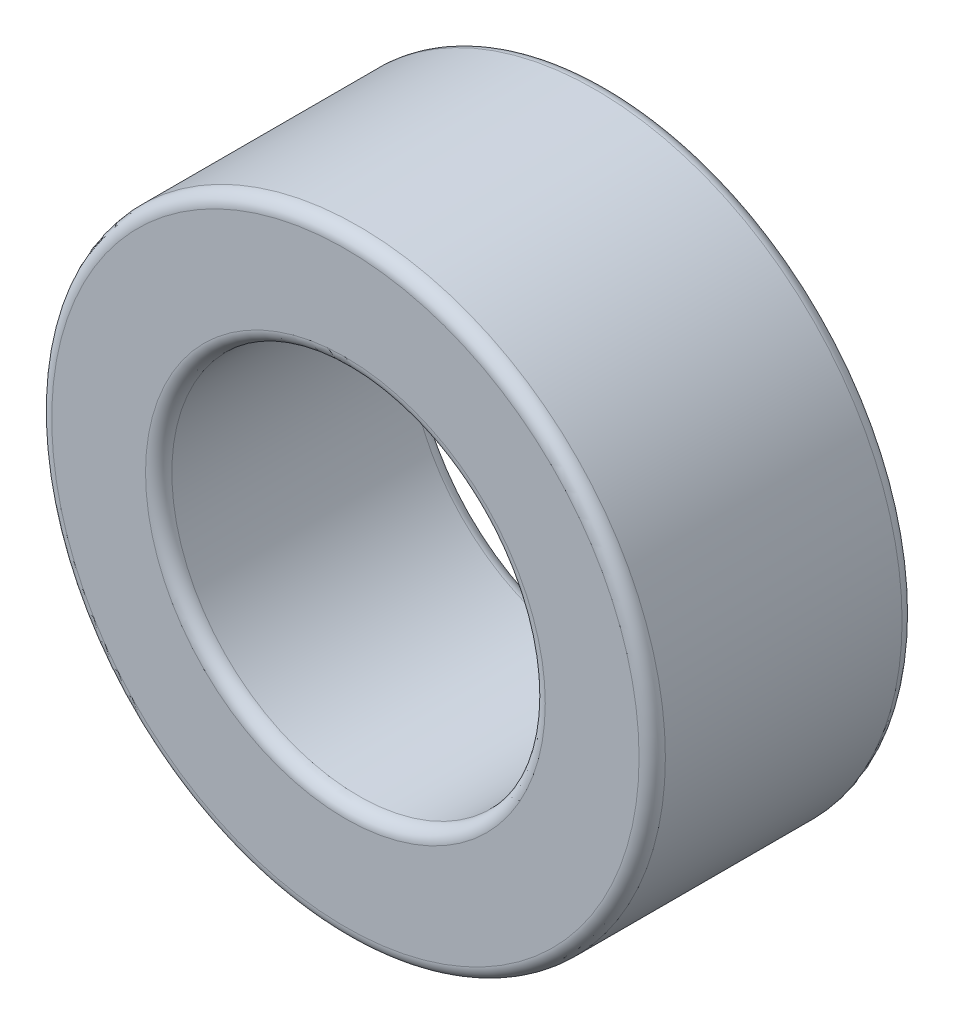
from build123d import *

# Parameters (mm, degrees)
SKETCH_1_R      = 3.5
SKETCH_1_R_2    = 2.13
EXTRUDE_1_DEPTH = 3
FILLET_1_R      = 0.15


with BuildPart() as part:
    # 草图1 → 凸台-拉伸1 (new body)
    with BuildSketch(Plane.XY):
        Circle(SKETCH_1_R)
        Circle(SKETCH_1_R_2, mode=Mode.SUBTRACT)
    extrude(amount=EXTRUDE_1_DEPTH)

    # 圆角1
    fillet_1_edges = [part.edges().sort_by_distance(p)[0] for p in [
        (-3.5, 0, 0),
        (-3.5, 0, 3),
        (-2.13, 0, 0),
        (-2.13, 0, 3),
    ]]
    fillet(fillet_1_edges, radius=FILLET_1_R)


solid = part.part
